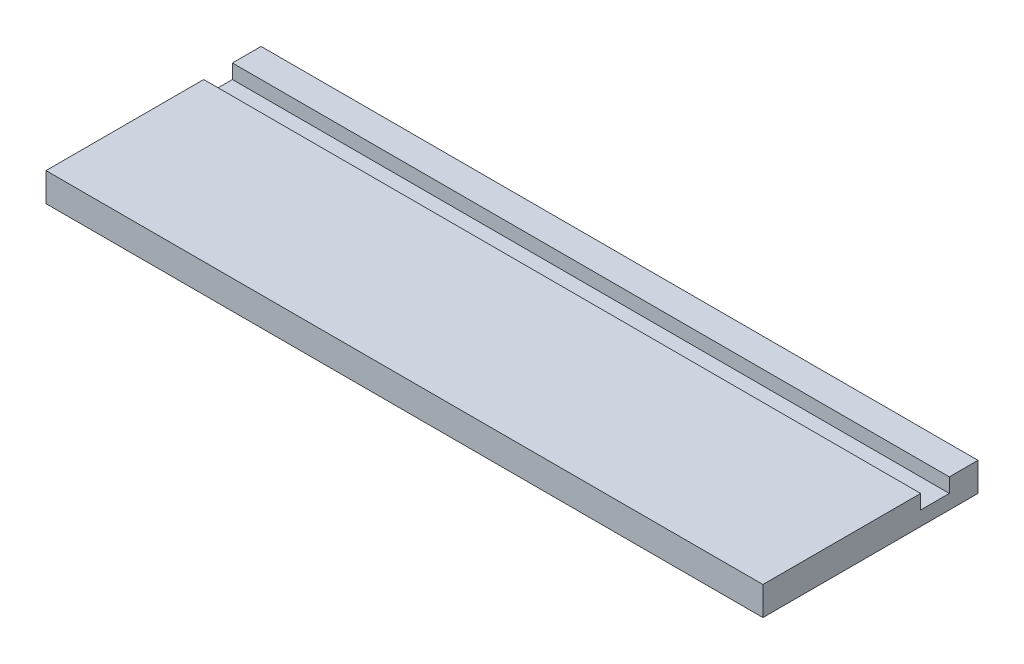
from build123d import *

# Parameters (mm, degrees)
ESQUISSE1_W             = 500
ESQUISSE1_H             = 150
BOSS_EXTRU_1_DEPTH      = 20
ESQUISSE2_W             = 500
ESQUISSE2_H             = 20
ENL_V_MAT_EXTRU_1_DEPTH = 10


with BuildPart() as part:
    # Esquisse1 → Boss.-Extru.1 (new body)
    with BuildSketch(Plane(origin=(0, 0, 0), x_dir=(1, 0, 0), z_dir=(0, 1, 0))):
        Rectangle(ESQUISSE1_W, ESQUISSE1_H)
    extrude(amount=BOSS_EXTRU_1_DEPTH)

    # Esquisse2 → Enlèv. mat.-Extru.1 (cut)
    with BuildSketch(Plane(origin=(0, 20, 0), x_dir=(1, 0, 0), z_dir=(0, 1, 0))):
        with Locations((0, 45)):
            Rectangle(ESQUISSE2_W, ESQUISSE2_H)
    extrude(amount=-ENL_V_MAT_EXTRU_1_DEPTH, mode=Mode.SUBTRACT)


solid = part.part
